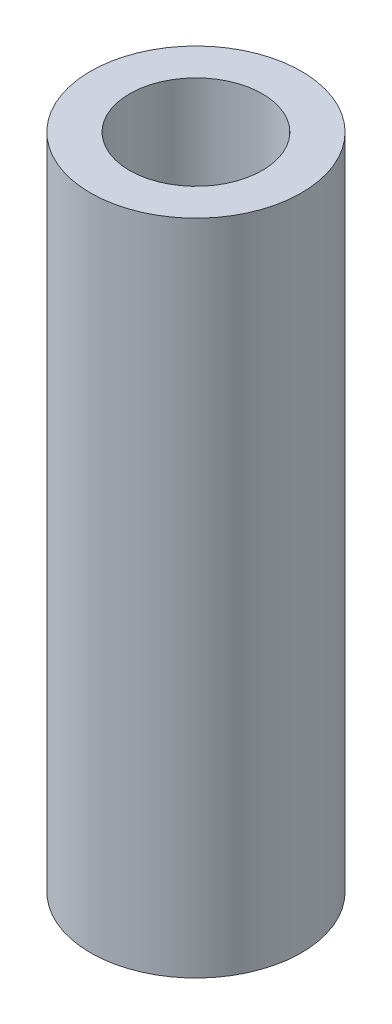
from build123d import *

# Parameters (mm, degrees)
SKETCH1_R           = 3.175
SKETCH1_R_2         = 2
BOSS_EXTRUDE1_DEPTH = 19.812


with BuildPart() as part:
    # Sketch1 → Boss-Extrude1 (new body)
    with BuildSketch(Plane(origin=(0, 0, 0), x_dir=(1, 0, 0), z_dir=(0, 1, 0))):
        with Locations(Location((0, 0, 0), (0, 0, 270))):
            Circle(SKETCH1_R)
        with Locations(Location((0, 0, 0), (0, 0, 270))):
            Circle(SKETCH1_R_2, mode=Mode.SUBTRACT)
    extrude(amount=-BOSS_EXTRUDE1_DEPTH)


solid = part.part
